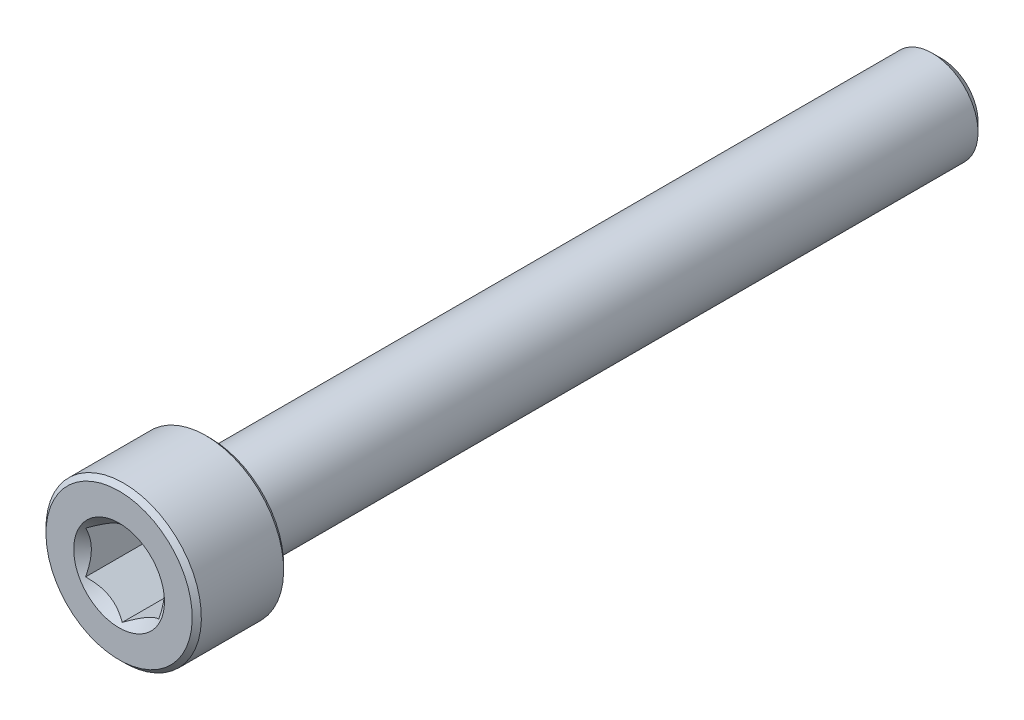
from build123d import *

# Parameters (mm, degrees)
CUT_EXTRUDE1_DEPTH = 4


with BuildPart() as part:
    # Sketch2 → Revolve1 (revolve)
    with BuildSketch(Plane(origin=(0, 0, 0), x_dir=(0, 0, -1), z_dir=(1, 0, 0))):
        with BuildLine():
            Line((-22.5, 0), (-22.5, 4))
            Line((-22.5, 4), (-22.25, 4.25))
            Line((-22.25, 4.25), (-17.75, 4.25))
            Line((-17.75, 4.25), (-17.5, 4))
            Line((-17.5, 4), (-17.5, 2.75))
            ThreePointArc((-17.5, 2.75), (-17.426776695, 2.573223305), (-17.25, 2.5))
            Line((-17.25, 2.5), (21.980384758, 2.5))
            Line((21.980384758, 2.5), (22.5, 1.980384758))
            Line((22.5, 1.980384758), (22.5, 0))
            Line((22.5, 0), (-22.5, 0))
        make_face()
    revolve(axis=Axis((0, 0, -22.5), (0, 0, 1)))

    # Sketch3 → Cut-Extrude1 (cut)
    with BuildSketch(Plane.XY.offset(22.5)):
        Polygon((2, -1.154700538), (2, 1.154700538), (0, 2.309401077), (-2, 1.154700538), (-2, -1.154700538), (0, -2.309401077), align=None)
    extrude(amount=-CUT_EXTRUDE1_DEPTH, mode=Mode.SUBTRACT)

    # Cut-Extrude2 cone 1 section (through the dimple's axis) → Cut-Extrude2 (revolve, cut)
    with BuildSketch(Plane(origin=(0, 0, 22.5), x_dir=(0, -1, 0), z_dir=(1, 0, 0))):
        Polygon((0, 0), (2.482606158, 0), (0, 2.482606158), align=None)
    revolve(axis=Axis((0, 0, 22.5), (0, 0, -1)), mode=Mode.SUBTRACT)


solid = part.part
